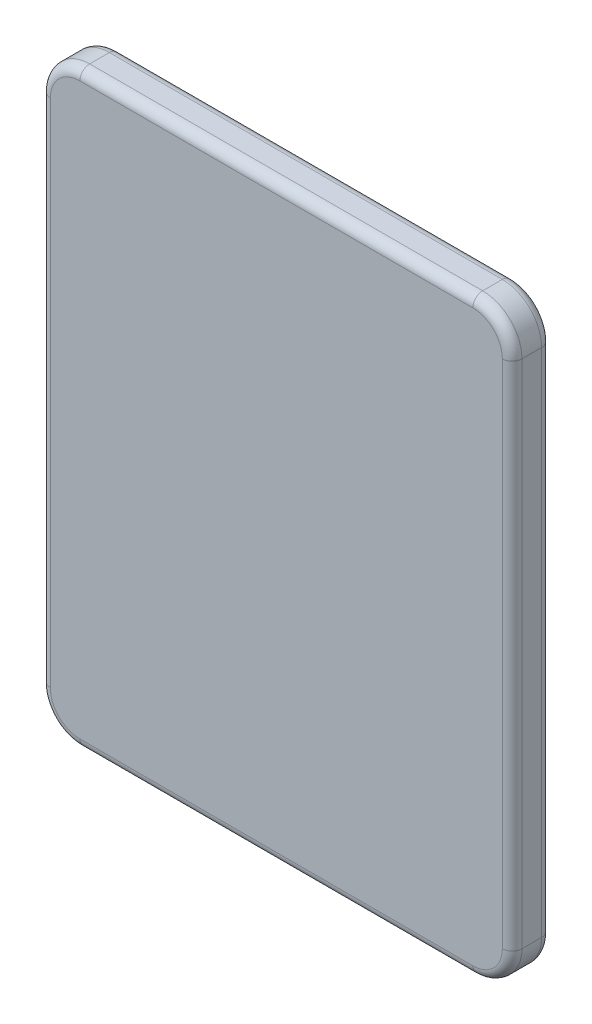
from build123d import *

# Parameters (mm, degrees)
SKETCH1_W           = 1200
SKETCH1_H           = 1500
BOSS_EXTRUDE1_DEPTH = 100
FILLET1_R           = 100
FILLET2_R           = 25


with BuildPart() as part:
    # Sketch1 → Boss-Extrude1 (new body)
    with BuildSketch(Plane.XY):
        Rectangle(SKETCH1_W, SKETCH1_H)
    extrude(amount=BOSS_EXTRUDE1_DEPTH)

    # Fillet1
    fillet1_edges = [part.edges().sort_by_distance(p)[0] for p in [
        (-600, 750, 50),
        (600, 750, 50),
        (600, -750, 50),
        (-600, -750, 50),
    ]]
    fillet(fillet1_edges, radius=FILLET1_R)

    # Fillet2
    fillet2_edges = [part.edges().sort_by_distance(p)[0] for p in [
        (0, -750, 0),
        (0, -750, 100),
        (-600, 0, 0),
        (0, 750, 0),
        (600, 0, 0),
        (-570.710678119, 720.710678119, 0),
        (570.710678119, 720.710678119, 0),
        (570.710678119, -720.710678119, 0),
        (-570.710678119, -720.710678119, 0),
        (-600, 0, 100),
        (600, 0, 100),
        (0, 750, 100),
        (-570.710678119, 720.710678119, 100),
        (570.710678119, 720.710678119, 100),
        (570.710678119, -720.710678119, 100),
        (-570.710678119, -720.710678119, 100),
    ]]
    fillet(fillet2_edges, radius=FILLET2_R)


solid = part.part
